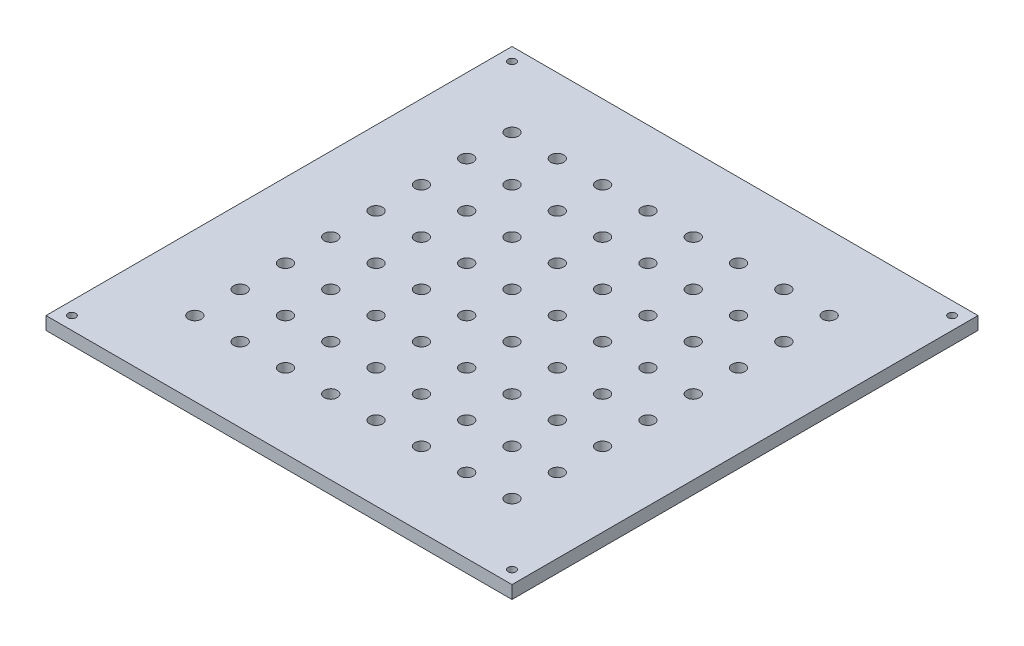
from build123d import *

# Parameters (mm, degrees)
SKETCH2_W        = 180
SKETCH2_H        = 180
SKETCH2_R        = 2.5
SKETCH2_R_2      = 1.5
KHUNG_MICA_DEPTH = 5


with BuildPart() as part:
    # Sketch2 → khung_mica (new body)
    with BuildSketch(Plane(origin=(0, 0, 0), x_dir=(1, 0, 0), z_dir=(0, 1, 0))):
        Rectangle(SKETCH2_W, SKETCH2_H)
        with Locations(Location((-61.25, 61.25, 0), (0, 0, 270))):
            Circle(SKETCH2_R, mode=Mode.SUBTRACT)
        with Locations(Location((-43.75, 61.25, 0), (0, 0, 270))):
            Circle(SKETCH2_R, mode=Mode.SUBTRACT)
        with Locations(Location((-26.25, 61.25, 0), (0, 0, 270))):
            Circle(SKETCH2_R, mode=Mode.SUBTRACT)
        with Locations(Location((-8.75, 61.25, 0), (0, 0, 270))):
            Circle(SKETCH2_R, mode=Mode.SUBTRACT)
        with Locations(Location((8.75, 61.25, 0), (0, 0, 270))):
            Circle(SKETCH2_R, mode=Mode.SUBTRACT)
        with Locations(Location((26.25, 61.25, 0), (0, 0, 270))):
            Circle(SKETCH2_R, mode=Mode.SUBTRACT)
        with Locations(Location((43.75, 61.25, 0), (0, 0, 270))):
            Circle(SKETCH2_R, mode=Mode.SUBTRACT)
        with Locations(Location((61.25, 61.25, 0), (0, 0, 270))):
            Circle(SKETCH2_R, mode=Mode.SUBTRACT)
        with Locations(Location((-43.75, 43.75, 0), (0, 0, 270))):
            Circle(SKETCH2_R, mode=Mode.SUBTRACT)
        with Locations(Location((-61.25, 43.75, 0), (0, 0, 270))):
            Circle(SKETCH2_R, mode=Mode.SUBTRACT)
        with Locations(Location((-26.25, 43.75, 0), (0, 0, 270))):
            Circle(SKETCH2_R, mode=Mode.SUBTRACT)
        with Locations(Location((-8.75, 43.75, 0), (0, 0, 270))):
            Circle(SKETCH2_R, mode=Mode.SUBTRACT)
        with Locations(Location((8.75, 43.75, 0), (0, 0, 270))):
            Circle(SKETCH2_R, mode=Mode.SUBTRACT)
        with Locations(Location((26.25, 43.75, 0), (0, 0, 270))):
            Circle(SKETCH2_R, mode=Mode.SUBTRACT)
        with Locations(Location((43.75, 43.75, 0), (0, 0, 270))):
            Circle(SKETCH2_R, mode=Mode.SUBTRACT)
        with Locations(Location((61.25, 43.75, 0), (0, 0, 270))):
            Circle(SKETCH2_R, mode=Mode.SUBTRACT)
        with Locations(Location((-43.75, 26.25, 0), (0, 0, 270))):
            Circle(SKETCH2_R, mode=Mode.SUBTRACT)
        with Locations(Location((-61.25, 26.25, 0), (0, 0, 270))):
            Circle(SKETCH2_R, mode=Mode.SUBTRACT)
        with Locations(Location((-26.25, 26.25, 0), (0, 0, 270))):
            Circle(SKETCH2_R, mode=Mode.SUBTRACT)
        with Locations(Location((-8.75, 26.25, 0), (0, 0, 270))):
            Circle(SKETCH2_R, mode=Mode.SUBTRACT)
        with Locations(Location((8.75, 26.25, 0), (0, 0, 270))):
            Circle(SKETCH2_R, mode=Mode.SUBTRACT)
        with Locations(Location((26.25, 26.25, 0), (0, 0, 270))):
            Circle(SKETCH2_R, mode=Mode.SUBTRACT)
        with Locations(Location((43.75, 26.25, 0), (0, 0, 270))):
            Circle(SKETCH2_R, mode=Mode.SUBTRACT)
        with Locations(Location((61.25, 26.25, 0), (0, 0, 270))):
            Circle(SKETCH2_R, mode=Mode.SUBTRACT)
        with Locations(Location((-43.75, 8.75, 0), (0, 0, 270))):
            Circle(SKETCH2_R, mode=Mode.SUBTRACT)
        with Locations(Location((-61.25, 8.75, 0), (0, 0, 270))):
            Circle(SKETCH2_R, mode=Mode.SUBTRACT)
        with Locations(Location((-26.25, 8.75, 0), (0, 0, 270))):
            Circle(SKETCH2_R, mode=Mode.SUBTRACT)
        with Locations(Location((-8.75, 8.75, 0), (0, 0, 270))):
            Circle(SKETCH2_R, mode=Mode.SUBTRACT)
        with Locations(Location((8.75, 8.75, 0), (0, 0, 270))):
            Circle(SKETCH2_R, mode=Mode.SUBTRACT)
        with Locations(Location((26.25, 8.75, 0), (0, 0, 270))):
            Circle(SKETCH2_R, mode=Mode.SUBTRACT)
        with Locations(Location((43.75, 8.75, 0), (0, 0, 270))):
            Circle(SKETCH2_R, mode=Mode.SUBTRACT)
        with Locations(Location((61.25, 8.75, 0), (0, 0, 270))):
            Circle(SKETCH2_R, mode=Mode.SUBTRACT)
        with Locations(Location((-43.75, -8.75, 0), (0, 0, 270))):
            Circle(SKETCH2_R, mode=Mode.SUBTRACT)
        with Locations(Location((-61.25, -8.75, 0), (0, 0, 270))):
            Circle(SKETCH2_R, mode=Mode.SUBTRACT)
        with Locations(Location((-26.25, -8.75, 0), (0, 0, 270))):
            Circle(SKETCH2_R, mode=Mode.SUBTRACT)
        with Locations(Location((-8.75, -8.75, 0), (0, 0, 270))):
            Circle(SKETCH2_R, mode=Mode.SUBTRACT)
        with Locations(Location((8.75, -8.75, 0), (0, 0, 270))):
            Circle(SKETCH2_R, mode=Mode.SUBTRACT)
        with Locations(Location((26.25, -8.75, 0), (0, 0, 270))):
            Circle(SKETCH2_R, mode=Mode.SUBTRACT)
        with Locations(Location((43.75, -8.75, 0), (0, 0, 270))):
            Circle(SKETCH2_R, mode=Mode.SUBTRACT)
        with Locations(Location((61.25, -8.75, 0), (0, 0, 270))):
            Circle(SKETCH2_R, mode=Mode.SUBTRACT)
        with Locations(Location((-43.75, -26.25, 0), (0, 0, 270))):
            Circle(SKETCH2_R, mode=Mode.SUBTRACT)
        with Locations(Location((-61.25, -26.25, 0), (0, 0, 270))):
            Circle(SKETCH2_R, mode=Mode.SUBTRACT)
        with Locations(Location((-26.25, -26.25, 0), (0, 0, 270))):
            Circle(SKETCH2_R, mode=Mode.SUBTRACT)
        with Locations(Location((-8.75, -26.25, 0), (0, 0, 270))):
            Circle(SKETCH2_R, mode=Mode.SUBTRACT)
        with Locations(Location((8.75, -26.25, 0), (0, 0, 270))):
            Circle(SKETCH2_R, mode=Mode.SUBTRACT)
        with Locations(Location((26.25, -26.25, 0), (0, 0, 270))):
            Circle(SKETCH2_R, mode=Mode.SUBTRACT)
        with Locations(Location((43.75, -26.25, 0), (0, 0, 270))):
            Circle(SKETCH2_R, mode=Mode.SUBTRACT)
        with Locations(Location((61.25, -26.25, 0), (0, 0, 270))):
            Circle(SKETCH2_R, mode=Mode.SUBTRACT)
        with Locations(Location((-43.75, -43.75, 0), (0, 0, 270))):
            Circle(SKETCH2_R, mode=Mode.SUBTRACT)
        with Locations(Location((-61.25, -43.75, 0), (0, 0, 270))):
            Circle(SKETCH2_R, mode=Mode.SUBTRACT)
        with Locations(Location((-26.25, -43.75, 0), (0, 0, 270))):
            Circle(SKETCH2_R, mode=Mode.SUBTRACT)
        with Locations(Location((-8.75, -43.75, 0), (0, 0, 270))):
            Circle(SKETCH2_R, mode=Mode.SUBTRACT)
        with Locations(Location((8.75, -43.75, 0), (0, 0, 270))):
            Circle(SKETCH2_R, mode=Mode.SUBTRACT)
        with Locations(Location((26.25, -43.75, 0), (0, 0, 270))):
            Circle(SKETCH2_R, mode=Mode.SUBTRACT)
        with Locations(Location((43.75, -43.75, 0), (0, 0, 270))):
            Circle(SKETCH2_R, mode=Mode.SUBTRACT)
        with Locations(Location((61.25, -43.75, 0), (0, 0, 270))):
            Circle(SKETCH2_R, mode=Mode.SUBTRACT)
        with Locations(Location((-43.75, -61.25, 0), (0, 0, 270))):
            Circle(SKETCH2_R, mode=Mode.SUBTRACT)
        with Locations(Location((-61.25, -61.25, 0), (0, 0, 270))):
            Circle(SKETCH2_R, mode=Mode.SUBTRACT)
        with Locations(Location((-26.25, -61.25, 0), (0, 0, 270))):
            Circle(SKETCH2_R, mode=Mode.SUBTRACT)
        with Locations(Location((-8.75, -61.25, 0), (0, 0, 270))):
            Circle(SKETCH2_R, mode=Mode.SUBTRACT)
        with Locations(Location((8.75, -61.25, 0), (0, 0, 270))):
            Circle(SKETCH2_R, mode=Mode.SUBTRACT)
        with Locations(Location((26.25, -61.25, 0), (0, 0, 270))):
            Circle(SKETCH2_R, mode=Mode.SUBTRACT)
        with Locations(Location((43.75, -61.25, 0), (0, 0, 270))):
            Circle(SKETCH2_R, mode=Mode.SUBTRACT)
        with Locations(Location((61.25, -61.25, 0), (0, 0, 270))):
            Circle(SKETCH2_R, mode=Mode.SUBTRACT)
        with Locations(Location((-85, 85, 0), (0, 0, 270))):
            Circle(SKETCH2_R_2, mode=Mode.SUBTRACT)
        with Locations(Location((85, 85, 0), (0, 0, 270))):
            Circle(SKETCH2_R_2, mode=Mode.SUBTRACT)
        with Locations(Location((85, -85, 0), (0, 0, 270))):
            Circle(SKETCH2_R_2, mode=Mode.SUBTRACT)
        with Locations(Location((-85, -85, 0), (0, 0, 270))):
            Circle(SKETCH2_R_2, mode=Mode.SUBTRACT)
    extrude(amount=KHUNG_MICA_DEPTH)


solid = part.part
